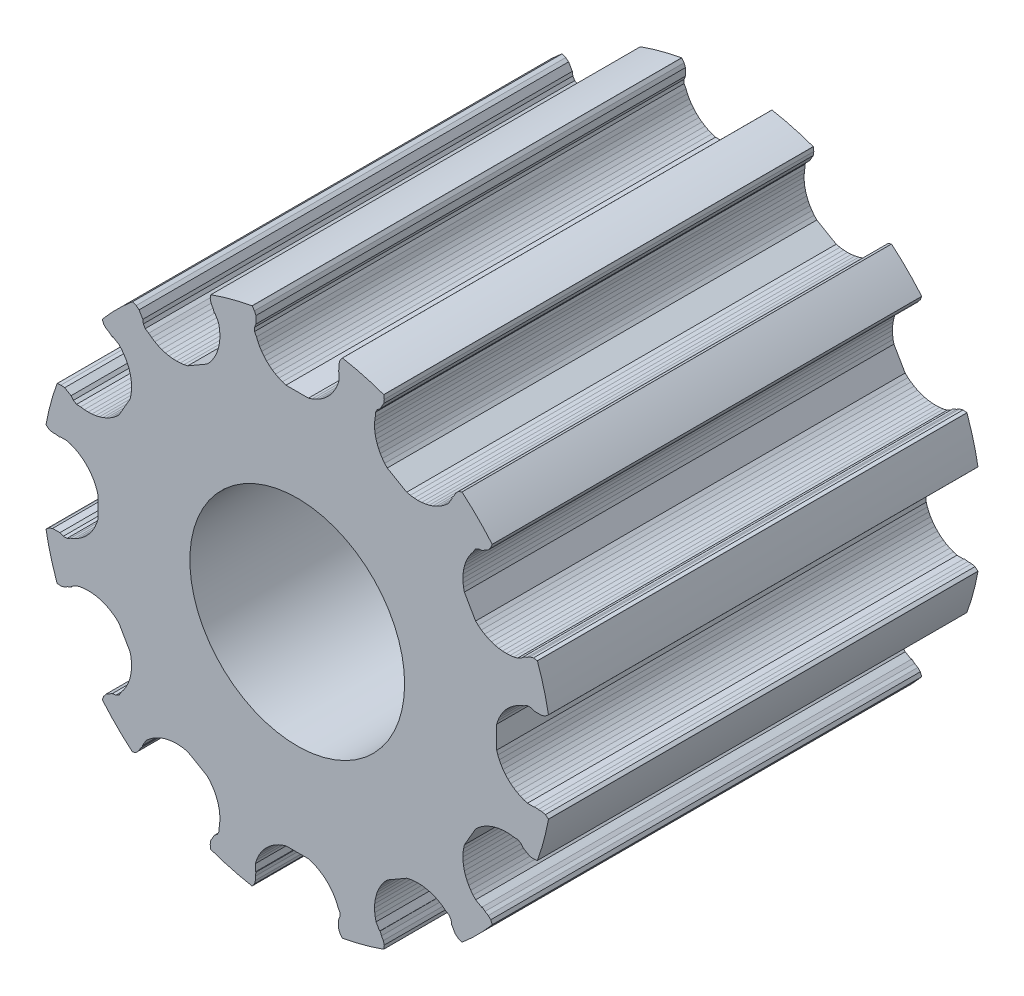
from build123d import *

# Parameters (mm, degrees)
SKETCH1_R           = 3.565718634
SKETCH1_R_2         = 1.5
BOSS_EXTRUDE1_DEPTH = 6
CUT_EXTRUDE2_DEPTH  = 6.2
CIRPATTERN1_COUNT   = 12


with BuildPart() as part:
    # Sketch1 → Boss-Extrude1 (new body)
    with BuildSketch(Plane.XY):
        Circle(SKETCH1_R)
        Circle(SKETCH1_R_2, mode=Mode.SUBTRACT)
    extrude(amount=BOSS_EXTRUDE1_DEPTH)

    # Sketch2 → Cut-Extrude2 (cut)
    with BuildSketch(Plane.XY):
        Polygon((4.065718634, 1), (3.565718634, 1), (3.565718634, 0.77), (3.565718634, 0.718417901), (3.539111505, 0.67032597), (3.507538441, 0.62897822), (3.466369512, 0.597172338), (3.418390305, 0.577060385), (3.366847209, 0.577060385), (3.315227751, 0.577060385), (3.267024625, 0.596047442), (3.21538666, 0.596047442), (3.164934738, 0.56892705), (3.116054088, 0.54879046), (3.069117941, 0.524463557), (3.02448468, 0.496132088), (2.982495103, 0.464012381), (2.943469824, 0.428349687), (2.907706823, 0.38941631), (2.875479168, 0.347509527), (2.847032937, 0.30294932), (2.822585331, 0.25607593), (2.802323021, 0.207247261), (2.786400721, 0.156836146), (2.786400721, 0.105227501), (2.786400721, 0.052815388), (2.786400721, 0), (2.786400721, -0.052815388), (2.786400721, -0.105227501), (2.786400721, -0.156836146), (2.802323021, -0.207247261), (2.822585331, -0.25607593), (2.847032937, -0.30294932), (2.875479168, -0.347509527), (2.907706823, -0.38941631), (2.943469824, -0.428349687), (2.982495103, -0.464012381), (3.02448468, -0.496132088), (3.069117941, -0.524463557), (3.116054088, -0.54879046), (3.164934738, -0.56892705), (3.21538666, -0.584719572), (3.315227751, -0.584719572), (3.315227751, -0.576478242), (3.366847209, -0.584719572), (3.418390305, -0.584719572), (3.466369512, -0.597172338), (3.507538441, -0.62897822), (3.539111505, -0.67032597), (3.558952397, -0.718417901), (3.558952397, -0.77), (3.558952397, -1), (4.065718634, -1), align=None)
    cut_extrude2 = extrude(amount=CUT_EXTRUDE2_DEPTH, mode=Mode.SUBTRACT)

    # CirPattern1: Cut-Extrude2 ×12 about axis
    cirpattern1_axis = Axis((0, 0, -0.3), (0, 0, 1))
    for i in range(1, CIRPATTERN1_COUNT):
        add(cut_extrude2.rotate(cirpattern1_axis, i * 360 / CIRPATTERN1_COUNT), mode=Mode.SUBTRACT)


solid = part.part
